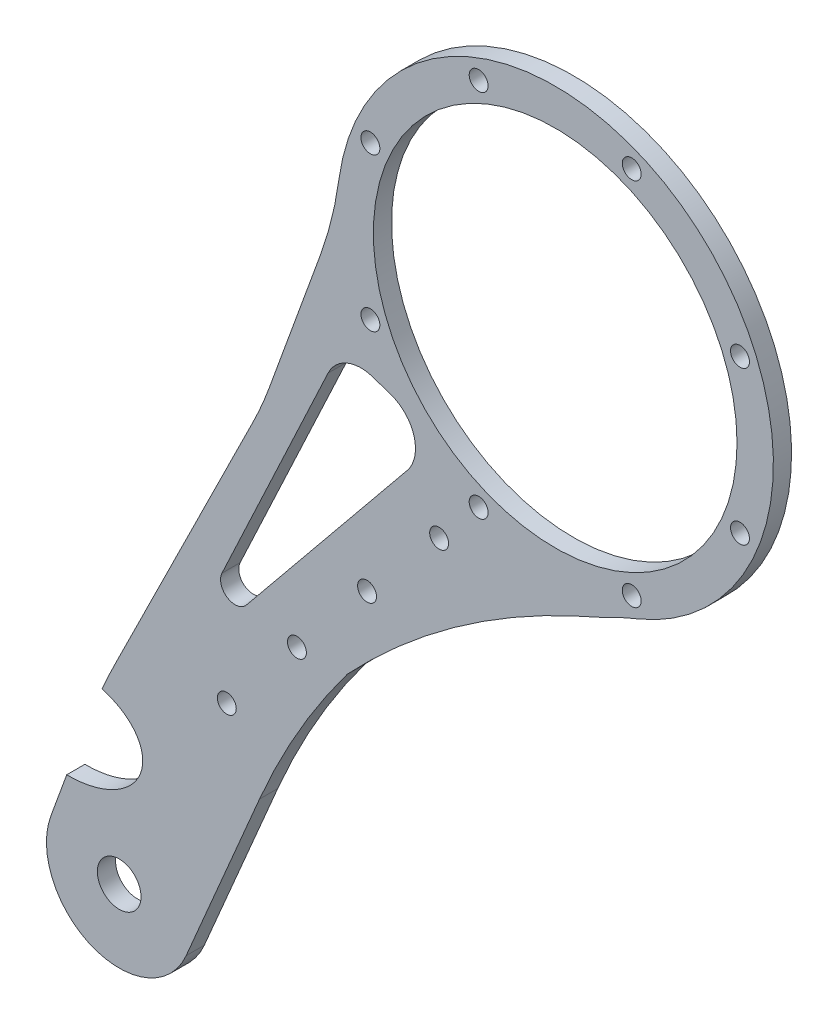
from build123d import *

# Parameters (mm, degrees)
SKETCH_1_R          = 1.85
SKETCH_1_R_2        = 6
SKETCH_1_R_3        = 2.6
SKETCH_1_R_4        = 40
EXTRUDE_1_DEPTH     = 5
SKETCH_2_R          = 50
CUT_EXTRUDE_1_DEPTH = 5


with BuildPart() as part:
    # 草图1 → 凸台-拉伸1 (new body)
    with BuildSketch(Plane.XY):
        with BuildLine():
            Line((45.340426295, 11.113882118), (52.986920218, 14.612571091))
            ThreePointArc((52.986920218, 14.612571091), (57.510180634, 16.855144901), (62.140860345, 18.86656915))
            ThreePointArc((62.140860345, 18.86656915), (76.473592144, 121.843079098), (-19.812815771, 82.619152052))
            ThreePointArc((-19.812815771, 82.619152052), (-21.816180826, 72.160455141), (-24.920337213, 61.974090443))
            Line((-24.920337213, 61.974090443), (-38.992341568, 23.311576231))
            ThreePointArc((-38.992341568, 23.311576231), (-41.02904615, 18.163814554), (-43.347502102, 13.136650558))
            Line((-43.347502102, 13.136650558), (-81.294613945, -63.493156131))
            ThreePointArc((-81.294613945, -63.493156131), (-83.173683364, -67.393304084), (-84.967894718, -71.333210372))
            add(Edge.make_bspline(
                [(-94.673253721, -96.669107716), (-78.493027504, -96.908185151), (-74.407692057, -86.243392693), (-70.32235661, -75.578600234), (-84.967894718, -71.333210372)],
                knots=[1.469085418, 1.469085418, 1.469085418, 2.850930512, 2.850930512, 4.232775606, 4.232775606, 4.232775606], degree=2, weights=[1, 0.770658452, 1, 0.770658452, 1]))
            Line((-94.673253721, -96.669107716), (-99.039465007, -108.665174635))
            ThreePointArc((-99.039465007, -108.665174635), (-87.586525496, -134.109636137), (-61.84467438, -123.341741928))
            Line((-61.84467438, -123.341741928), (-41.665865642, -75.957716718))
            ThreePointArc((-41.665865642, -75.957716718), (-30.867859398, -54.330265242), (-17.539479197, -34.163513461))
            ThreePointArc((-17.539479197, -34.163513461), (11.686808966, -8.450543885), (45.340426295, 11.113882118))
        make_face()
        with Locations((84.133254342, 74.484980418)):
            Circle(SKETCH_1_R, mode=Mode.SUBTRACT)
        with Locations((-4.866745658, 74.484980418)):
            Circle(SKETCH_1_R, mode=Mode.SUBTRACT)
        with Locations((71.099506104, 43.018728655)):
            Circle(SKETCH_1_R, mode=Mode.SUBTRACT)
        with Locations((-80.245612592, -115.505577501)):
            Circle(SKETCH_1_R_2, mode=Mode.SUBTRACT)
        with Locations((71.099506104, 105.95123218)):
            Circle(SKETCH_1_R, mode=Mode.SUBTRACT)
        with Locations((39.633254342, 29.984980418)):
            Circle(SKETCH_1_R, mode=Mode.SUBTRACT)
        with Locations((8.167002579, 43.018728655)):
            Circle(SKETCH_1_R, mode=Mode.SUBTRACT)
        with Locations((8.167002579, 105.95123218)):
            Circle(SKETCH_1_R, mode=Mode.SUBTRACT)
        with Locations((39.633254342, 118.984980418)):
            Circle(SKETCH_1_R, mode=Mode.SUBTRACT)
        with Locations((90.44662863, 95.532569198)):
            Circle(SKETCH_1_R_3, mode=Mode.SUBTRACT)
        with Locations((60.680843122, 125.298354706)):
            Circle(SKETCH_1_R_3, mode=Mode.SUBTRACT)
        with Locations((18.585665562, 125.298354706)):
            Circle(SKETCH_1_R_3, mode=Mode.SUBTRACT)
        with Locations((-11.180119947, 95.532569198)):
            Circle(SKETCH_1_R_3, mode=Mode.SUBTRACT)
        with Locations((-11.180119947, 53.437391637)):
            Circle(SKETCH_1_R_3, mode=Mode.SUBTRACT)
        with Locations((18.585665562, 23.671606129)):
            Circle(SKETCH_1_R_3, mode=Mode.SUBTRACT)
        with Locations((60.680843122, 23.671606129)):
            Circle(SKETCH_1_R_3, mode=Mode.SUBTRACT)
        with Locations((90.44662863, 53.437391637)):
            Circle(SKETCH_1_R_3, mode=Mode.SUBTRACT)
        with Locations((-31.375823455, -34.648004813)):
            Circle(SKETCH_1_R_3, mode=Mode.SUBTRACT)
        with Locations((7.718202275, 10.862157861)):
            Circle(SKETCH_1_R_3, mode=Mode.SUBTRACT)
        with Locations((-12.092195165, -11.66667152)):
            Circle(SKETCH_1_R_3, mode=Mode.SUBTRACT)
        with Locations((-50.659451746, -57.629338107)):
            Circle(SKETCH_1_R_3, mode=Mode.SUBTRACT)
        with Locations((39.633254342, 74.484980418)):
            Circle(SKETCH_1_R_4, mode=Mode.SUBTRACT)
        with BuildLine():
            Line((-5.536305869, 38.415363853), (-10.514583927, 40.122913857))
            ThreePointArc((-10.514583927, 40.122913857), (-17.662135878, 39.870705025), (-22.813209689, 34.909097746))
            Line((-22.813209689, 34.909097746), (-51.994954934, -27.329380157))
            ThreePointArc((-51.994954934, -27.329380157), (-50.503277554, -32.413196821), (-45.27475721, -31.55711955))
            Line((-45.27475721, -31.55711955), (-1.034437322, 22.632199259))
            ThreePointArc((-1.034437322, 22.632199259), (0.835703515, 31.699245343), (-5.536305869, 38.415363853))
        make_face(mode=Mode.SUBTRACT)
    extrude(amount=EXTRUDE_1_DEPTH)

    # 草图2 → 切除-拉伸1 (cut)
    with BuildSketch(Plane.XY.offset(5)):
        with Locations((39.633254342, 74.484980418)):
            Circle(SKETCH_2_R)
    extrude(amount=-CUT_EXTRUDE_1_DEPTH, mode=Mode.SUBTRACT)


solid = part.part
